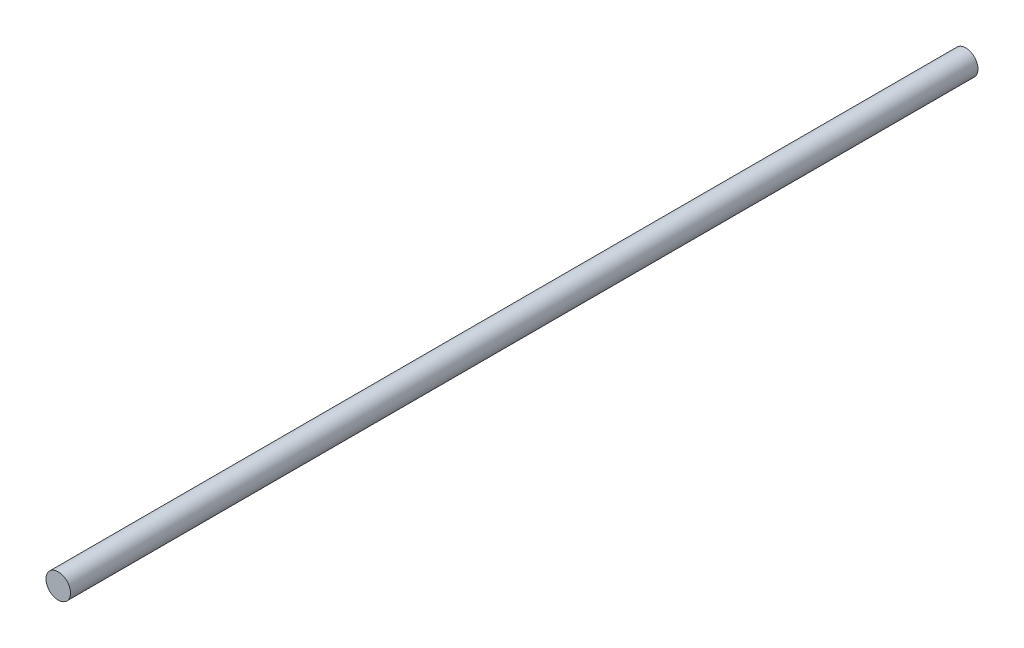
from build123d import *

# Parameters (mm, degrees)
SKETCH1_R           = 1.5875
BOSS_EXTRUDE1_DEPTH = 117.475


with BuildPart() as part:
    # Sketch1 → Boss-Extrude1 (new body)
    with BuildSketch(Plane.XY):
        Circle(SKETCH1_R)
    extrude(amount=BOSS_EXTRUDE1_DEPTH)


solid = part.part
